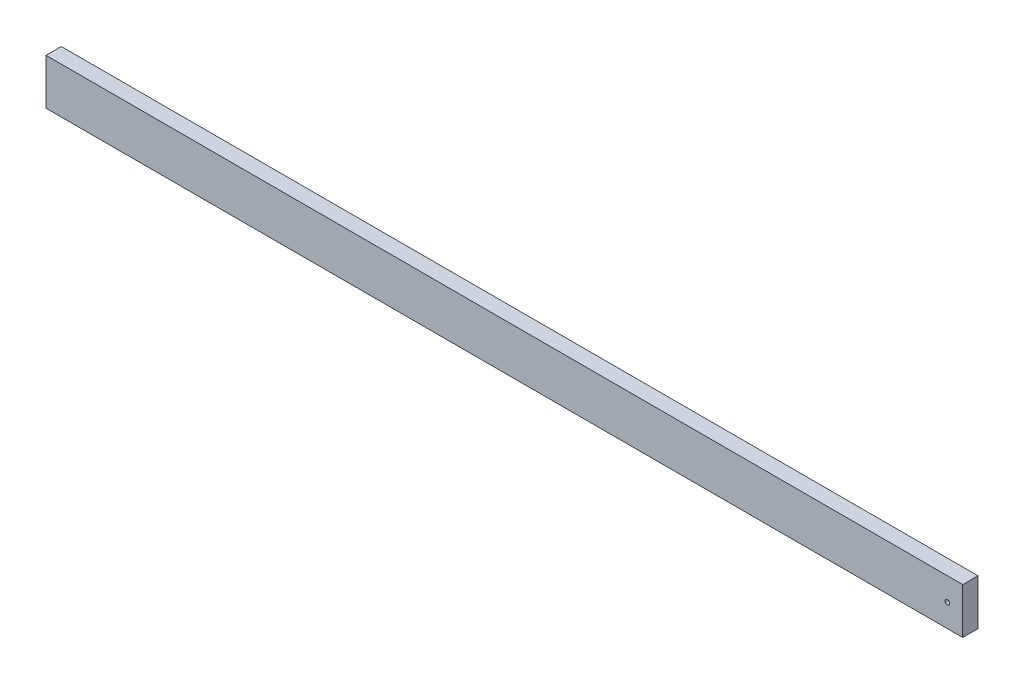
from build123d import *

# Parameters (mm, degrees)
SKETCH1_W           = 600
SKETCH1_H           = 30
SKETCH1_R           = 1.5
BOSS_EXTRUDE1_DEPTH = 10


with BuildPart() as part:
    # Sketch1 → Boss-Extrude1 (new body)
    with BuildSketch(Plane.XY):
        Rectangle(SKETCH1_W, SKETCH1_H)
        with Locations((290, 0)):
            Circle(SKETCH1_R, mode=Mode.SUBTRACT)
    extrude(amount=BOSS_EXTRUDE1_DEPTH)


solid = part.part
